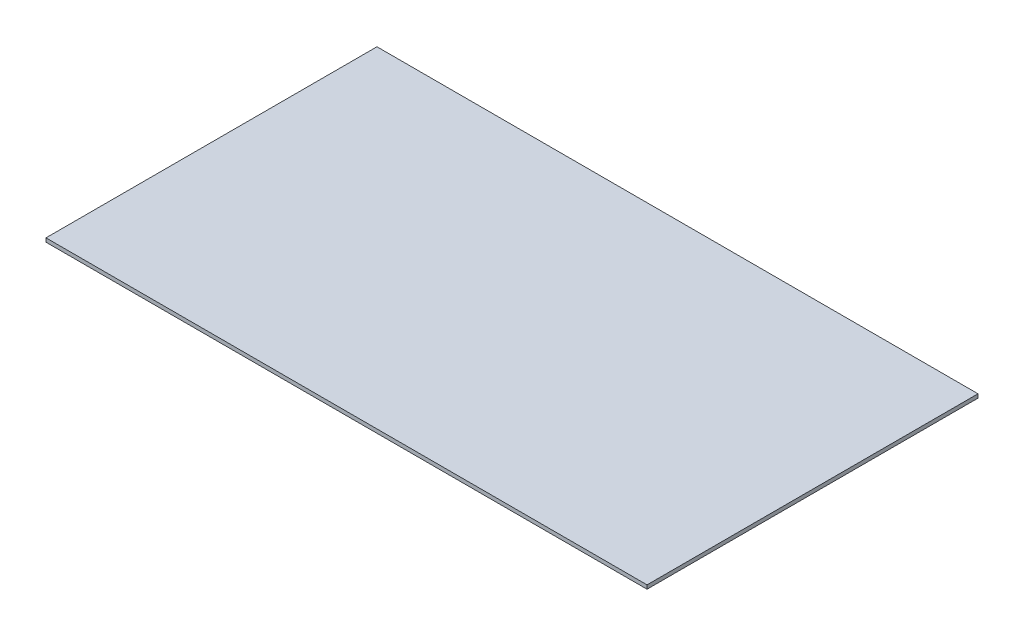
from build123d import *

# Parameters (mm, degrees)
SKETCH_1_W      = 1580
SKETCH_1_H      = 10
EXTRUDE_1_DEPTH = 870


with BuildPart() as part:
    # Эскиз1 → Бобышка-Вытянуть1 (new body)
    with BuildSketch(Plane.XY):
        with Locations((-790, 45)):
            Rectangle(SKETCH_1_W, SKETCH_1_H)
    extrude(amount=-EXTRUDE_1_DEPTH)


solid = part.part
